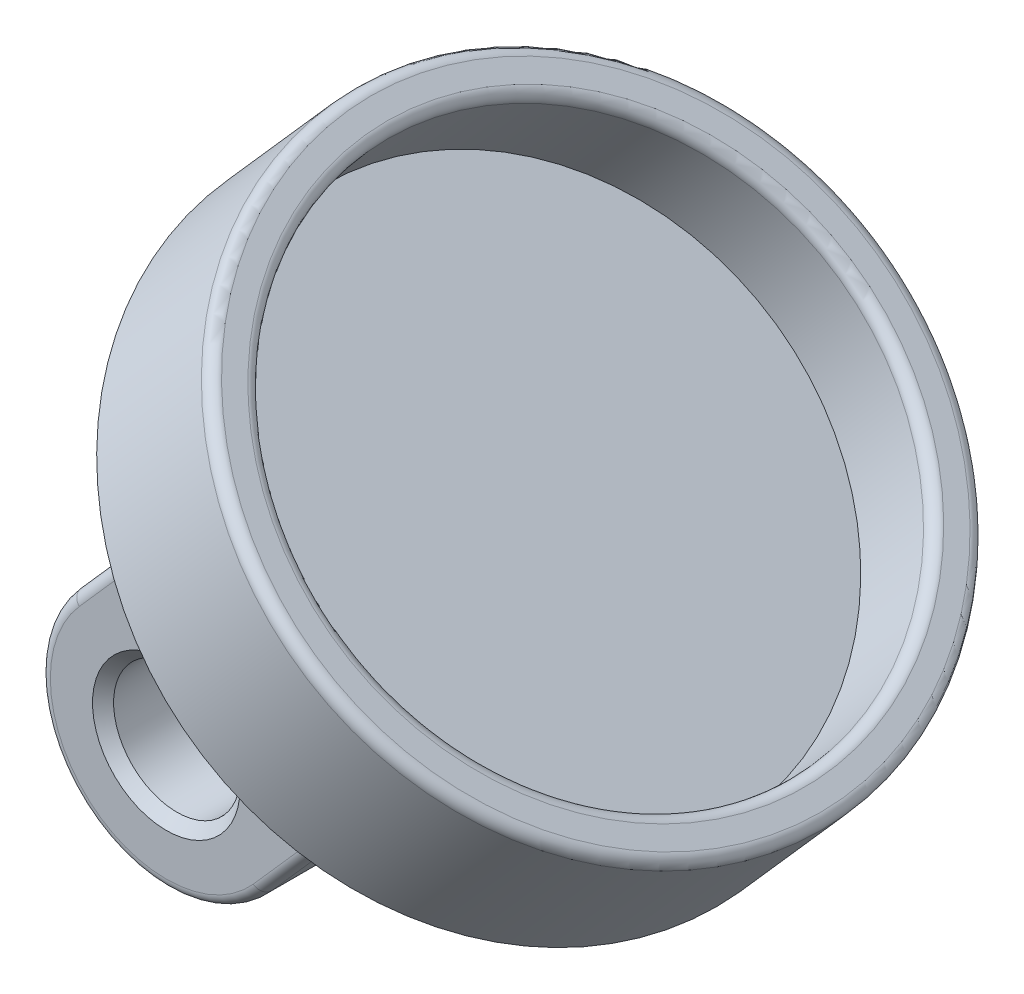
from build123d import *

# Parameters (mm, degrees)
BOSS_EXTRUDE1_DEPTH      = 7
BOSS_EXTRUDE1_DEPTH_BACK = 7
SKETCH2_R                = 3.0000000000000018
BOSS_EXTRUDE2_DEPTH      = 2
BOSS_EXTRUDE2_DEPTH_BACK = 2
SKETCH3_R                = 14.700000000000001
BOSS_EXTRUDE3_START      = 5
SKETCH4_R                = 14.700000000000001
SKETCH4_R_2              = 12.699999999999998
BOSS_EXTRUDE3_DEPTH      = 5
FILLET2_R                = 0.5
FILLET4_R                = 0.5
CHAMFER1_SIZE            = 0.5
CHAMFER2_SIZE            = 1


with BuildPart() as part:
    # Sketch2 → Boss-Extrude1 (new, two sides: drawn at the far end of the back side and taken through both)
    with BuildSketch(Plane.XY.offset(-BOSS_EXTRUDE1_DEPTH_BACK)):
        with BuildLine():
            Line((30.512377936980783, 70.89647327651264), (21.781878923827843, 61.0053372557492))
            ThreePointArc((21.781878923827843, 61.0053372557492), (13.313031061350836, 60.477496482202135), (12.78519028780376, 68.94634434467913))
            Line((12.78519028780376, 68.94634434467913), (21.51568930095671, 78.83748036544256))
            Line((21.51568930095671, 78.83748036544256), (30.512377936980783, 70.89647327651264))
        make_face()
        with Locations((17.283534605815802, 64.97584080021417)):
            Circle(SKETCH2_R, mode=Mode.SUBTRACT)
    extrude(amount=BOSS_EXTRUDE1_DEPTH + BOSS_EXTRUDE1_DEPTH_BACK)

    # Sketch3 → Boss-Extrude2 (add, two sides: drawn at the far end of the back side and taken through both)
    with BuildSketch(Plane(origin=(48.53568375746082, 54.98804239970119, 0), x_dir=(0.7497240530020064, -0.66175059074416, 0), z_dir=(0.66175059074416, 0.7497240530020064, 0)).offset(-BOSS_EXTRUDE2_DEPTH_BACK)):
        with Locations((-30.039919418767553, 0)):
            Circle(SKETCH3_R)
    extrude(amount=BOSS_EXTRUDE2_DEPTH + BOSS_EXTRUDE2_DEPTH_BACK)

    # Sketch4 → Boss-Extrude3 (add)
    with BuildSketch(Plane(origin=(49.85918493894915, 56.48749050570521, 0), x_dir=(0.7497240530020064, -0.66175059074416, 0), z_dir=(0.66175059074416, 0.7497240530020064, 0)).offset(BOSS_EXTRUDE3_START)):
        with Locations((-30.03991941876756, 0)):
            Circle(SKETCH4_R)
        with Locations((-30.03991941876756, 0)):
            Circle(SKETCH4_R_2, mode=Mode.SUBTRACT)
    extrude(amount=-BOSS_EXTRUDE3_DEPTH)

    # Fillet2
    fillet2_edges = [part.edges().sort_by_distance(p)[0] for p in [
        (21.12479228105238, 88.51927769444247, -1.56e-15),
        (19.62534417504836, 89.84277887593079, -1.8e-15),
    ]]
    fillet(fillet2_edges, radius=FILLET2_R)

    # Fillet4
    fillet4_edges = [part.edges().sort_by_distance(p)[0] for p in [
        (25.48537783966015, 65.2011812131289, -7),
        (13.313031061350841, 60.47749648220213, -7),
        (16.488689203636067, 73.14218830205883, -7),
        (25.48537783966015, 65.2011812131289, 7),
        (13.313031061350841, 60.47749648220213, 7),
        (16.488689203636067, 73.14218830205883, 7),
    ]]
    fillet(fillet4_edges, radius=FILLET4_R)

    # Chamfer1
    chamfer1_edges = [part.edges().sort_by_distance(p)[0] for p in [
        (14.2835346058158, 64.97584080021417, 7),
        (14.2835346058158, 64.97584080021417, -7),
    ]]
    chamfer(chamfer1_edges, length=CHAMFER1_SIZE)

    # Chamfer2
    chamfer2_edges = [part.edges().sort_by_distance(p)[0] for p in [
        (20.301982665021182, 77.24112112915115, 6.853553390593271),
        (20.192188119468376, 77.33803225943853, -7e-17),
        (20.301982665021182, 77.24112112915115, -6.853553390593271),
        (24.690532437480417, 73.36752871497357, -7),
        (29.079082209939642, 69.493936300796, -6.853553390593275),
        (29.18887675549246, 69.39702517050861, -7e-17),
        (29.079082209939642, 69.493936300796, 6.853553390593275),
        (24.690532437480417, 73.36752871497357, 7),
        (13.66958885835092, 83.09526239891272, -1.8e-15),
    ]]
    chamfer(chamfer2_edges, length=CHAMFER2_SIZE)


solid = part.part
